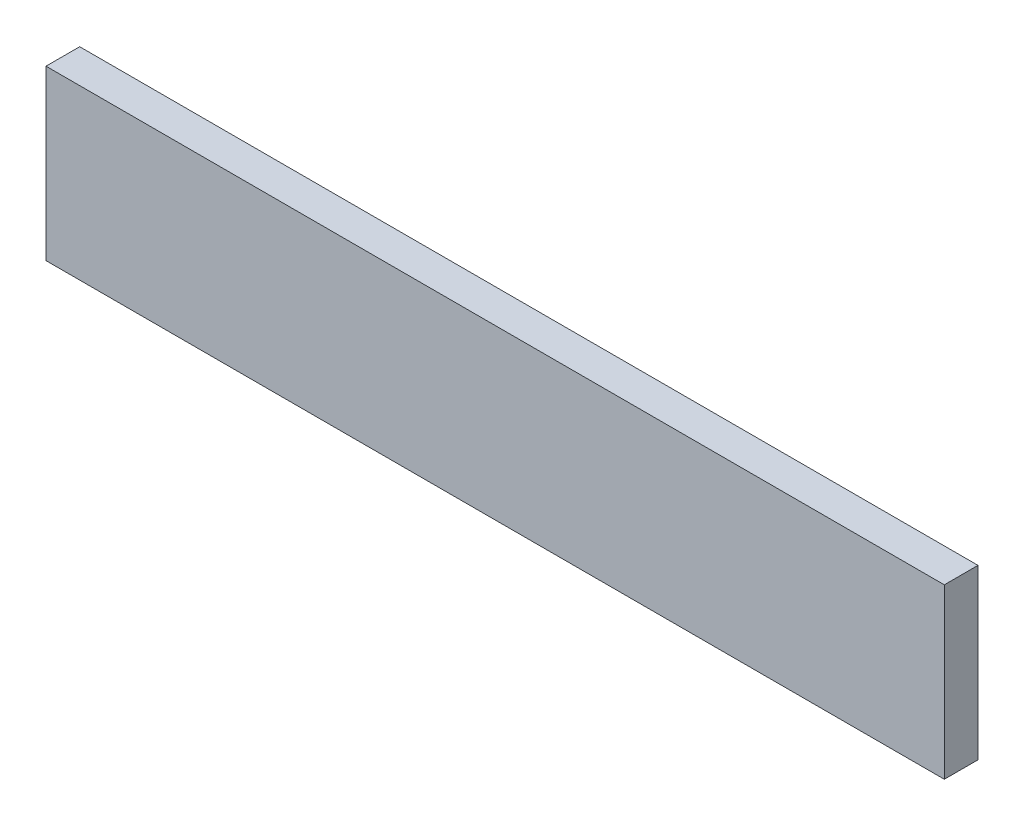
from build123d import *

# Parameters (mm, degrees)
ESQUISSE1_W        = 80
ESQUISSE1_H        = 15
BOSS_EXTRU_1_DEPTH = 3


with BuildPart() as part:
    # Esquisse1 → Boss.-Extru.1 (new body)
    with BuildSketch(Plane.XY):
        Rectangle(ESQUISSE1_W, ESQUISSE1_H)
    extrude(amount=BOSS_EXTRU_1_DEPTH)


solid = part.part
